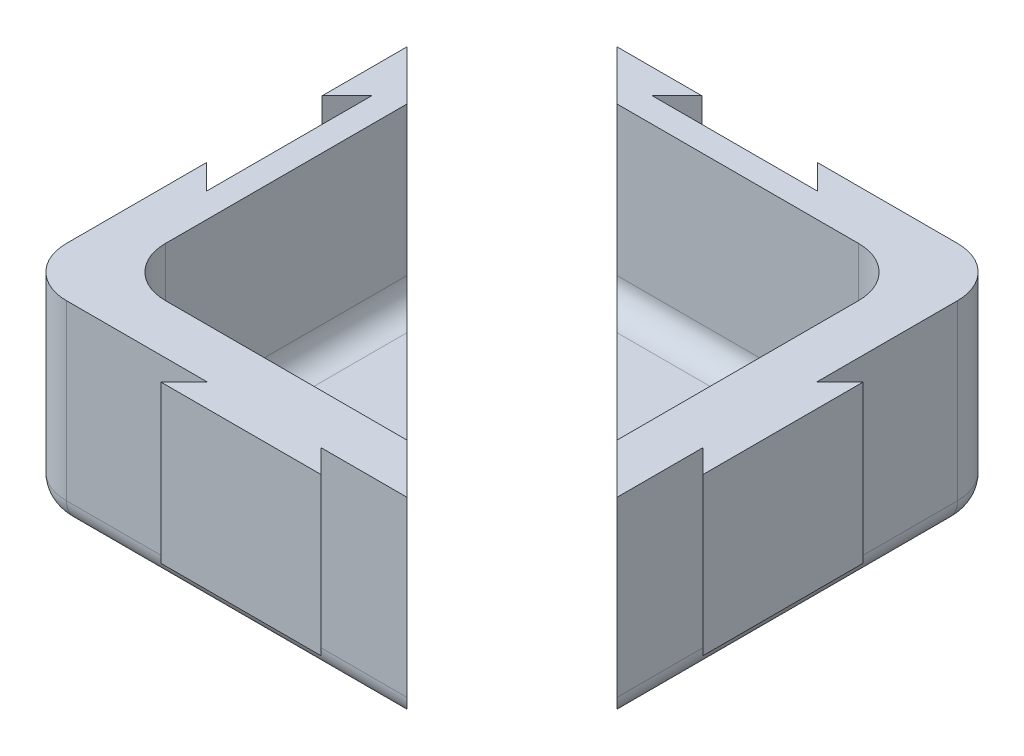
from build123d import *

# Parameters (mm, degrees)
SKETCH1_W                    = 100
SKETCH1_H                    = 100
BOSS_EXTRUDE1_DEPTH          = 40
SHELL1_T                     = -10
SHELL1_THICKNESS_2_FACE_W    = 80
SHELL1_THICKNESS_2_FACE_H    = 80
SHELL1_THICKNESS_2_DEPTH     = 5
CUT_EXTRUDE1_DEPTH           = 32
BOSS_EXTRUDE2_DEPTH          = 31.7
CUT_EXTRUDE2_DEPTH           = 32
BOSS_EXTRUDE3_DEPTH          = 31.7
FILLET1_R                    = 10
FILLET2_R                    = 5
CUT_EXTRUDE_THIN1_DEPTH      = 88.087197681
CUT_EXTRUDE_THIN1_DEPTH_BACK = 88.087197681


with BuildPart() as part:
    # Sketch1 → Boss-Extrude1 (new body)
    with BuildSketch(Plane(origin=(0, 0, 0), x_dir=(1, 0, 0), z_dir=(0, 1, 0))):
        Rectangle(SKETCH1_W, SKETCH1_H)
    extrude(amount=BOSS_EXTRUDE1_DEPTH)

    # Shell1
    shell1_openings = [part.faces().sort_by_distance(p)[0] for p in [
        (0, 40, 0),
    ]]
    offset(amount=SHELL1_T, openings=shell1_openings, kind=Kind.INTERSECTION)

    # Shell1 thickness 2 face (on inner face of the shell) → Shell1 thickness 2 (cut)
    with BuildSketch(Plane(origin=(0, 10, 0), x_dir=(0, 0, -1), z_dir=(0, -1, 0))):
        Rectangle(SHELL1_THICKNESS_2_FACE_W, SHELL1_THICKNESS_2_FACE_H)
    extrude(amount=SHELL1_THICKNESS_2_DEPTH, mode=Mode.SUBTRACT)

    # Sketch2 → Cut-Extrude1 (cut)
    with BuildSketch(Plane(origin=(0, 40, 0), x_dir=(1, 0, 0), z_dir=(0, 1, 0))):
        Polygon((-11.666666667, 50), (-16.666666667, 45), (16.666666667, 45), (11.666666667, 50), align=None)
    extrude(amount=-CUT_EXTRUDE1_DEPTH, mode=Mode.SUBTRACT)

    # Sketch3 → Boss-Extrude2 (add)
    with BuildSketch(Plane(origin=(0, 40, 0), x_dir=(1, 0, 0), z_dir=(0, 1, 0))):
        Polygon((-11.454534632, -50), (-16.154534632, -54.7), (16.154534632, -54.7), (11.454534632, -50), align=None)
    extrude(amount=-BOSS_EXTRUDE2_DEPTH)

    # Sketch4 → Cut-Extrude2 (cut)
    with BuildSketch(Plane(origin=(0, 40, 0), x_dir=(1, 0, 0), z_dir=(0, 1, 0))):
        Polygon((-45, 16.666666667), (-45, -16.666666667), (-50, -11.666666667), (-50, 11.666666667), align=None)
    extrude(amount=-CUT_EXTRUDE2_DEPTH, mode=Mode.SUBTRACT)

    # Sketch5 → Boss-Extrude3 (add)
    with BuildSketch(Plane(origin=(0, 40, 0), x_dir=(1, 0, 0), z_dir=(0, 1, 0))):
        Polygon((50, 11.454534632), (50, -11.454534632), (54.7, -16.154534632), (54.7, 16.154534632), align=None)
    extrude(amount=-BOSS_EXTRUDE3_DEPTH)

    # Fillet1
    fillet1_edges = [part.edges().sort_by_distance(p)[0] for p in [
        (40, 22.5, 40),
        (40, 22.5, -40),
        (-40, 22.5, -40),
        (-40, 22.5, 40),
        (50, 20, 50),
        (-50, 20, 50),
        (-50, 20, -50),
        (50, 20, -50),
    ]]
    fillet(fillet1_edges, radius=FILLET1_R)

    # Fillet2
    fillet2_edges = [part.edges().sort_by_distance(p)[0] for p in [
        (-37.071067812, 5, -37.071067812),
        (37.071067812, 5, -37.071067812),
        (0, 0, -50),
        (50, 0, 0),
        (0, 0, 50),
        (-50, 0, 0),
        (47.071067812, 0, 47.071067812),
        (-47.071067812, 0, 47.071067812),
        (-47.071067812, 0, -47.071067812),
        (47.071067812, 0, -47.071067812),
        (40, 5, 0),
        (0, 5, -40),
        (-40, 5, 0),
        (0, 5, 40),
        (37.071067812, 5, 37.071067812),
        (-37.071067812, 5, 37.071067812),
    ]]
    fillet(fillet2_edges, radius=FILLET2_R)

    # Sketch6 → Cut-Extrude-Thin1 (cut, two sides: drawn at the far end of the back side and taken through both)
    with BuildSketch(Plane(origin=(0, 40, 0), x_dir=(1, 0, 0), z_dir=(0, 1, 0)).offset(-CUT_EXTRUDE_THIN1_DEPTH_BACK)):
        Polygon((-57.67766953, 36.464466094), (36.464466094, -57.67766953), (57.67766953, -36.464466094), (-36.464466094, 57.67766953), align=None)
    extrude(amount=CUT_EXTRUDE_THIN1_DEPTH + CUT_EXTRUDE_THIN1_DEPTH_BACK, mode=Mode.SUBTRACT)


with BuildPart() as cut_extrude_thin1_piece_1:
    # of the separate pieces the step leaves, piece 1, a body of its own (cut_extrude_thin1_pieces)
    add(part.part.solids().sort_by_distance((-28.786796564, 5, -50))[0])


with BuildPart() as cut_extrude_thin1_piece_2:
    # of the separate pieces the step leaves, piece 2, a body of its own (cut_extrude_thin1_pieces)
    add(part.part.solids().sort_by_distance((-40, 40, 50))[0])


solid = Compound([cut_extrude_thin1_piece_1.part, cut_extrude_thin1_piece_2.part])
